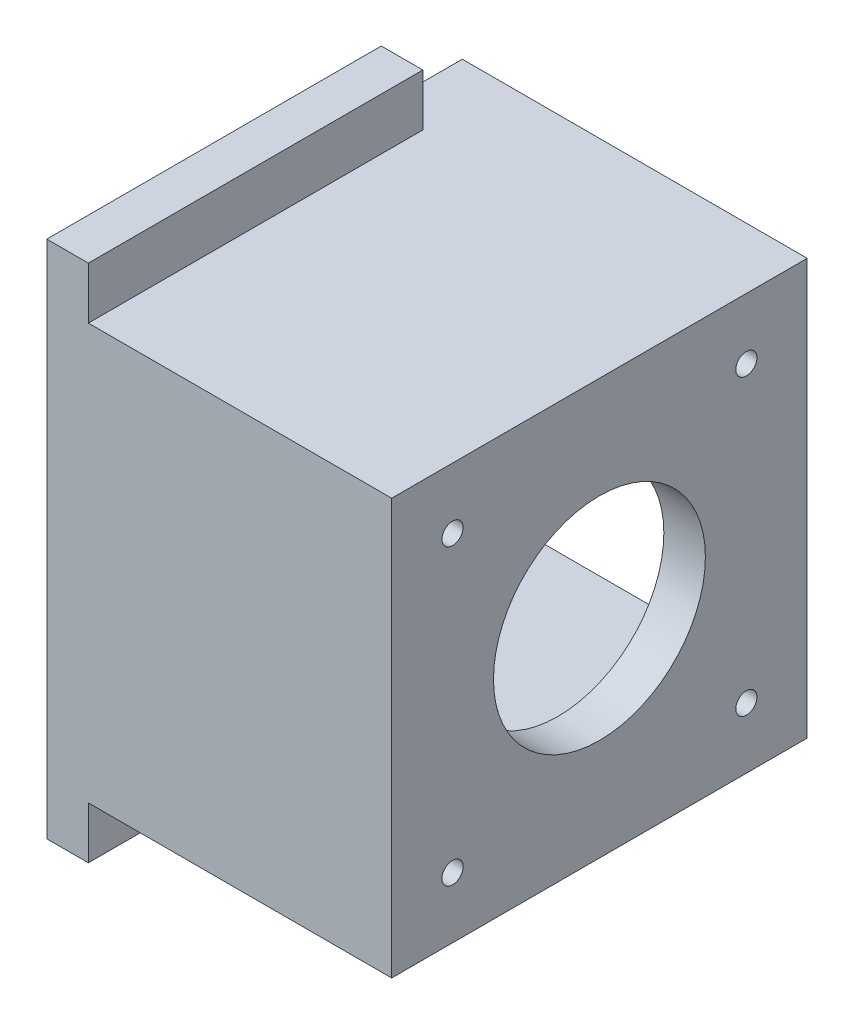
from build123d import *

# Parameters (mm, degrees)
EXTRUDE_1_DEPTH          = 200
SKETCH_2_W               = 39
SKETCH_2_H               = 25
CUT_EXTRUDE_1_DEPTH      = 20
SKETCH_3_W               = 126
SKETCH_3_H               = 160
CUT_EXTRUDE_2_DEPTH      = 180
CUT_EXTRUDE_3_REACH      = 362.633
SKETCH_4_R               = 51
SKETCH_5_R               = 25.5
CUT_EXTRUDE_4_DEPTH      = 15
SKETCH_6_R               = 57.15
CUT_EXTRUDE_5_DEPTH      = 5
PATTERN_CIRCULAR_1_COUNT = 4


with BuildPart() as part:
    # 草图1 → 凸台-拉伸1 (new body)
    with BuildSketch(Plane.XY):
        Polygon((20, 225), (20, 250), (0, 250), (0, 0), (20, 0), (20, 25), (166, 25), (166, 225), align=None)
    extrude(amount=-EXTRUDE_1_DEPTH)

    # 草图2 → 切除-拉伸1 (cut)
    with BuildSketch(Plane.ZY):
        with Locations((-180.5, 237.5)):
            Rectangle(SKETCH_2_W, SKETCH_2_H)
        with Locations((-180.5, 12.5)):
            Rectangle(SKETCH_2_W, SKETCH_2_H)
    extrude(amount=-CUT_EXTRUDE_1_DEPTH, mode=Mode.SUBTRACT)

    # 草图3 → 切除-拉伸2 (cut)
    with BuildSketch(Plane(origin=(0, 0, -200), x_dir=(-1, 0, 0), z_dir=(0, 0, -1))):
        with Locations((-83, 122.583335177)):
            Rectangle(SKETCH_3_W, SKETCH_3_H)
    extrude(amount=-CUT_EXTRUDE_2_DEPTH, mode=Mode.SUBTRACT)

    # 草图4 → 切除-拉伸3 (cut, up to next)
    with BuildSketch(Plane(origin=(166, 0, 0), x_dir=(0, 0, -1), z_dir=(1, 0, 0)), mode=Mode.PRIVATE) as cut_extrude_3_sk1:
        with Locations((100, 125)):
            Circle(SKETCH_4_R)
    cut_extrude_3_tool1 = extrude(cut_extrude_3_sk1.sketch, amount=-CUT_EXTRUDE_3_REACH, mode=Mode.PRIVATE) & part.part
    add(cut_extrude_3_tool1.solids().sort_by_distance((166, 125, -100))[0], mode=Mode.SUBTRACT)

    # 草图5 → 切除-拉伸4 (cut)
    with BuildSketch(Plane(origin=(20, 0, 0), x_dir=(0, 0, -1), z_dir=(1, 0, 0))):
        with Locations(Location((100, 125, 0), (0, 0, 90))):
            Circle(SKETCH_5_R)
    extrude(amount=-CUT_EXTRUDE_4_DEPTH, mode=Mode.SUBTRACT)

    # 草图6 → 切除-拉伸5 (cut)
    with BuildSketch(Plane.ZY):
        with Locations((-100, 125)):
            Circle(SKETCH_6_R)
    extrude(amount=-CUT_EXTRUDE_5_DEPTH, mode=Mode.SUBTRACT)

    # 草图9 → M12 螺纹孔1 (revolve, cut)
    with BuildSketch(Plane(origin=(166, 195.711356231, -170.71), x_dir=(0, 0, -1), z_dir=(0, 1, 0))):
        Polygon((0, 0), (0, 29.25), (5.1, 26.185610843), (5.1, 0), align=None)
    hole_wizard_m12_1 = revolve(axis=Axis((172.35, 195.711356231, -170.71), (-1, 0, 0)), mode=Mode.SUBTRACT)

    # 阵列(圆周)1: M12 螺纹孔1 ×4 about axis
    pattern_circular_1_axis = Axis((0, 125, -100), (1, 0, 0))
    for i in range(1, PATTERN_CIRCULAR_1_COUNT):
        add(hole_wizard_m12_1.rotate(pattern_circular_1_axis, i * 360 / PATTERN_CIRCULAR_1_COUNT), mode=Mode.SUBTRACT)


solid = part.part
